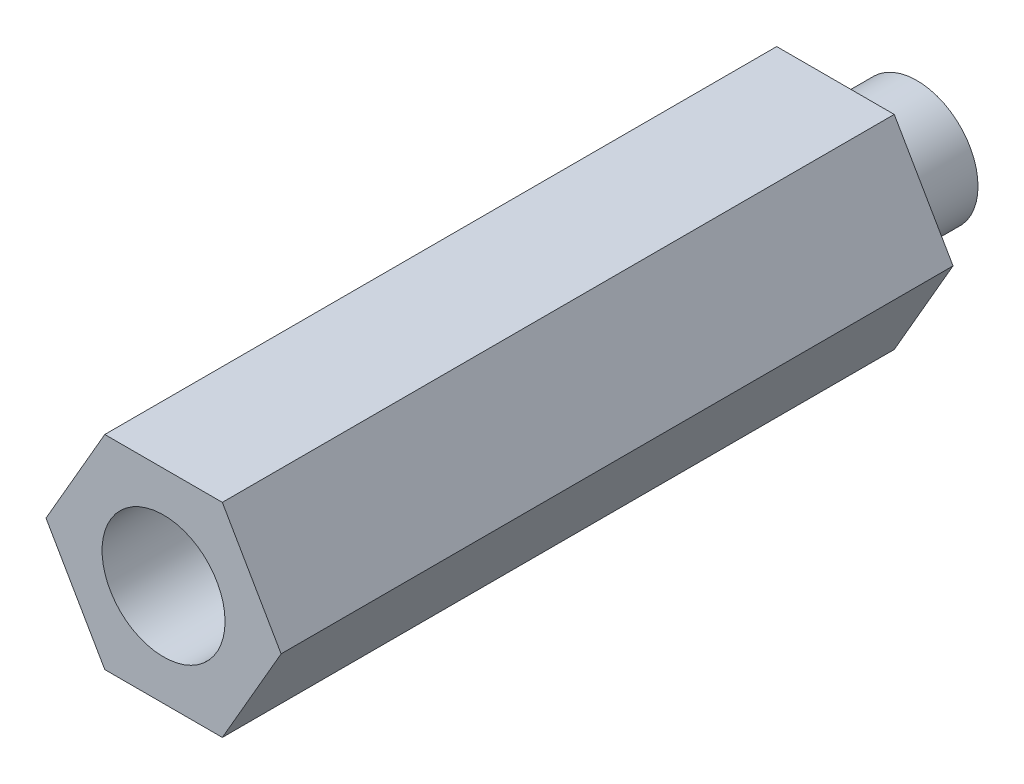
from build123d import *

# Parameters (mm, degrees)
FEMALE_M3_HEX_STANDOFF_AF5_SKETCH_R = 1.51
FEMALE_M3_HEX_STANDOFF_AF5_DEPTH    = 16.5
STUD_ROOT_SKETCH_R                  = 1.85
STUD_ROOT_DEPTH                     = 0.45
MALE_M3_STUD_ENVELOPE_START         = -2
MALE_M3_STUD_ENVELOPE_SKETCH_R      = 1.5
MALE_M3_STUD_ENVELOPE_DEPTH         = 2


with BuildPart() as part:
    # Female_M3_hex_standoff_AF5_Sketch → Female_M3_hex_standoff_AF5 (new body)
    with BuildSketch(Plane.XY):
        Polygon((2.886751346, 0), (1.443375673, 2.5), (-1.443375673, 2.5), (-2.886751346, 0), (-1.443375673, -2.5), (1.443375673, -2.5), align=None)
        Circle(FEMALE_M3_HEX_STANDOFF_AF5_SKETCH_R, mode=Mode.SUBTRACT)
    extrude(amount=FEMALE_M3_HEX_STANDOFF_AF5_DEPTH)

    # Stud_root_Sketch → Stud_root (add)
    with BuildSketch(Plane.XY):
        Circle(STUD_ROOT_SKETCH_R)
    extrude(amount=STUD_ROOT_DEPTH)

    # Male_M3_stud_envelope_Sketch → Male_M3_stud_envelope (add)
    with BuildSketch(Plane.XY.offset(MALE_M3_STUD_ENVELOPE_START)):
        Circle(MALE_M3_STUD_ENVELOPE_SKETCH_R)
    extrude(amount=MALE_M3_STUD_ENVELOPE_DEPTH)


solid = part.part
